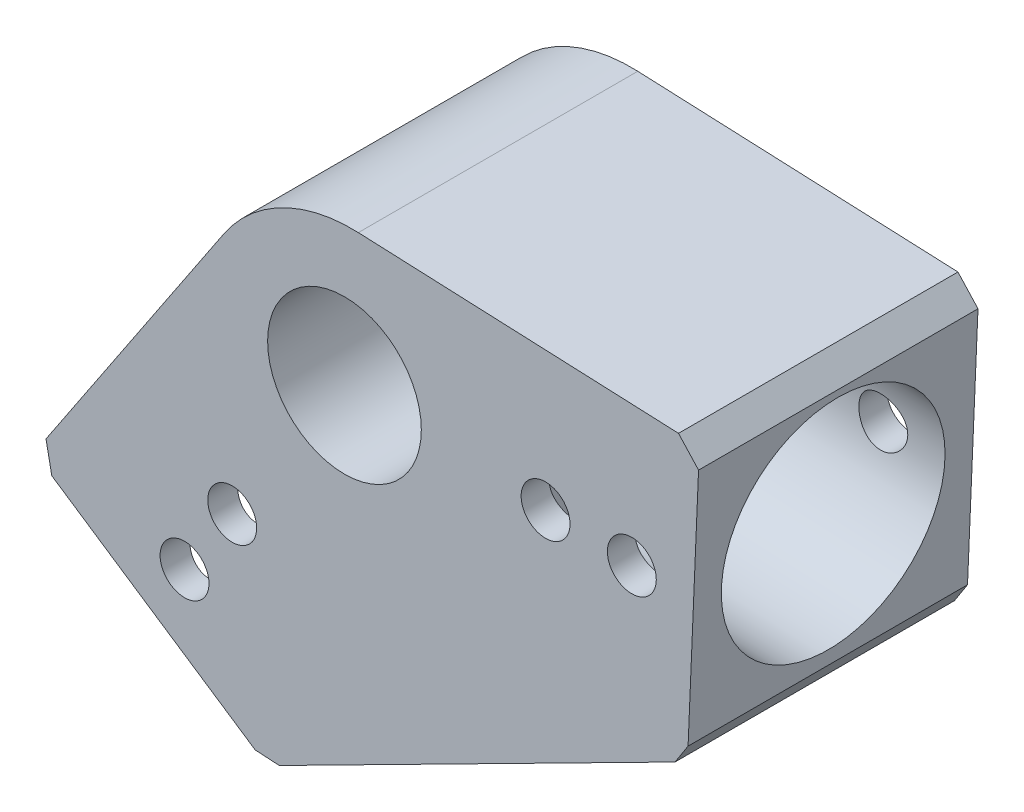
from build123d import *

# Parameters (mm, degrees)
BOSS_EXTRUDE6_DEPTH = 40
SKETCH9_R           = 16
CUT_EXTRUDE3_DEPTH  = 30
SKETCH10_R          = 16
CUT_EXTRUDE4_DEPTH  = 30
CUT_EXTRUDE5_REACH  = 89.959
SKETCH11_R          = 3.5
SKETCH12_R          = 11
CUT_EXTRUDE6_DEPTH  = 40
SKETCH14_W          = 106.764973624
SKETCH14_H          = 40
BOSS_EXTRUDE7_DEPTH = 5
CUT_EXTRUDE8_DEPTH  = 40
FILLET1_R           = 22
CHAMFER5_SIZE       = 2
CHAMFER6_SIZE       = 3
SKETCH16_R          = 5
CUT_EXTRUDE9_DEPTH  = 27


with BuildPart() as part:
    # Sketch8 → Boss-Extrude6 (new body)
    with BuildSketch(Plane.XY):
        Polygon((-57.969476198, -3.736595203), (37.23247397, 44.588846099), (50.811489539, 17.83795198), (-44.390460629, -30.487489322), align=None)
        Polygon((50.811489539, 17.83795198), (49.096562756, -22.125268937), (-11.118961612, -52.691258219), (-44.390460629, -30.487489322), align=None)
    extrude(amount=BOSS_EXTRUDE6_DEPTH)

    # Sketch9 → Cut-Extrude3 (cut)
    with BuildSketch(Plane(origin=(-27.75471112, -41.58937377, 0), x_dir=(-0.8317874754097543, 0.5550942224086534, 0), z_dir=(-0.5550942224086534, -0.8317874754097543, 0))):
        with Locations(Location((0, -20, 0), (0, 0, 180))):
            Circle(SKETCH9_R)
    extrude(amount=-CUT_EXTRUDE3_DEPTH, mode=Mode.SUBTRACT)

    # Sketch10 → Cut-Extrude4 (cut)
    with BuildSketch(Plane(origin=(49.954026147, -2.143658479, 0), x_dir=(0, 0, -1), z_dir=(0.9990805229464255, -0.04287316957138965, 0))):
        with Locations(Location((-20, 0, 0), (0, 0, 90))):
            Circle(SKETCH10_R)
    extrude(amount=-CUT_EXTRUDE4_DEPTH, mode=Mode.SUBTRACT)

    # Cut-Extrude5: up to this face of the body (flat: up to its plane)
    cut_extrude5_end = Plane(part.part.faces().sort_by_distance((3.278005206, -6.45772661, 40))[0])
    # Sketch11 → Cut-Extrude5 (cut, up to the picked face)
    with BuildSketch(Plane(origin=(0, 0, 0), x_dir=(-1, 0, 0), z_dir=(0, 0, -1)), mode=Mode.PRIVATE) as cut_extrude5_sk1:
        with Locations((16.072269088, -23.982451877)):
            Circle(SKETCH11_R)
    cut_extrude5_tool1 = split(extrude(cut_extrude5_sk1.sketch, amount=-CUT_EXTRUDE5_REACH, mode=Mode.PRIVATE), bisect_by=cut_extrude5_end, keep=Keep.BOTH, mode=Mode.PRIVATE)
    # Sketch11 → Cut-Extrude5 (cut, up to the picked face)
    with BuildSketch(Plane(origin=(0, 0, 0), x_dir=(-1, 0, 0), z_dir=(0, 0, -1)), mode=Mode.PRIVATE) as cut_extrude5_sk2:
        with Locations((22.894837472, -34.264871857)):
            Circle(SKETCH11_R)
    cut_extrude5_tool2 = split(extrude(cut_extrude5_sk2.sketch, amount=-CUT_EXTRUDE5_REACH, mode=Mode.PRIVATE), bisect_by=cut_extrude5_end, keep=Keep.BOTH, mode=Mode.PRIVATE)
    # Sketch11 → Cut-Extrude5 (cut, up to the picked face)
    with BuildSketch(Plane(origin=(0, 0, 0), x_dir=(-1, 0, 0), z_dir=(0, 0, -1)), mode=Mode.PRIVATE) as cut_extrude5_sk3:
        with Locations((-28.78289974, -1.065658383)):
            Circle(SKETCH11_R)
    cut_extrude5_tool3 = split(extrude(cut_extrude5_sk3.sketch, amount=-CUT_EXTRUDE5_REACH, mode=Mode.PRIVATE), bisect_by=cut_extrude5_end, keep=Keep.BOTH, mode=Mode.PRIVATE)
    # Sketch11 → Cut-Extrude5 (cut, up to the picked face)
    with BuildSketch(Plane(origin=(0, 0, 0), x_dir=(-1, 0, 0), z_dir=(0, 0, -1)), mode=Mode.PRIVATE) as cut_extrude5_sk4:
        with Locations((-41.131848905, -1.765246078)):
            Circle(SKETCH11_R)
    cut_extrude5_tool4 = split(extrude(cut_extrude5_sk4.sketch, amount=-CUT_EXTRUDE5_REACH, mode=Mode.PRIVATE), bisect_by=cut_extrude5_end, keep=Keep.BOTH, mode=Mode.PRIVATE)
    add(cut_extrude5_tool1.solids().sort_by(Axis((-16.072269, -23.982452, 0), (0, 0, 1)))[0], mode=Mode.SUBTRACT)
    add(cut_extrude5_tool2.solids().sort_by(Axis((-22.894837, -34.264872, 0), (0, 0, 1)))[0], mode=Mode.SUBTRACT)
    add(cut_extrude5_tool3.solids().sort_by(Axis((28.7829, -1.065658, 0), (0, 0, 1)))[0], mode=Mode.SUBTRACT)
    add(cut_extrude5_tool4.solids().sort_by(Axis((41.131849, -1.765246, 0), (0, 0, 1)))[0], mode=Mode.SUBTRACT)

    # Sketch12 → Cut-Extrude6 (cut)
    with BuildSketch(Plane(origin=(0, 0, 0), x_dir=(-1, 0, 0), z_dir=(0, 0, -1))):
        with Locations((0.002217481, -0.001125615)):
            Circle(SKETCH12_R)
    extrude(amount=-CUT_EXTRUDE6_DEPTH, mode=Mode.SUBTRACT)

    # Sketch14 → Boss-Extrude7 (add)
    with BuildSketch(Plane(origin=(-10.368501114, 20.426125448, 0), x_dir=(0.8916964706359383, 0.45263385230825515, 0), z_dir=(-0.45263385230825526, 0.8916964706359384, 0))):
        with Locations((0, -20)):
            Rectangle(SKETCH14_W, SKETCH14_H)
    extrude(amount=BOSS_EXTRUDE7_DEPTH)

    # Sketch15 → Cut-Extrude8 (cut)
    with BuildSketch(Plane(origin=(0, 0, 0), x_dir=(-1, 0, 0), z_dir=(0, 0, -1))):
        Polygon((20.486288281, 20.897526908), (10.387815393, 20.46417491), (44.390460629, -30.487489322), (60.232645459, 0.72188715), align=None)
        Polygon((-34.969304708, 49.047328453), (-50.811489539, 17.83795198), (10.387815393, 20.46417491), (4.777052471, 28.871688695), align=None)
        Polygon((4.777052471, 28.871688695), (10.387815393, 20.46417491), (20.486288281, 20.897526908), align=None)
    extrude(amount=-CUT_EXTRUDE8_DEPTH, mode=Mode.SUBTRACT)

    # Fillet1
    fillet1_edges = [part.edges().sort_by_distance(p)[0] for p in [
        (-10.387815393, 20.46417491, 20),
    ]]
    fillet(fillet1_edges, radius=FILLET1_R)

    # Chamfer5
    chamfer5_edges = [part.edges().sort_by_distance(p)[0] for p in [
        (49.096562756, -22.125268937, 20),
        (-11.118961612, -52.691258219, 20),
    ]]
    chamfer(chamfer5_edges, length=CHAMFER5_SIZE)

    # Chamfer6
    chamfer6_edges = [part.edges().sort_by_distance(p)[0] for p in [
        (50.811489539, 17.83795198, 20),
        (-44.390460629, -30.487489322, 20),
    ]]
    chamfer(chamfer6_edges, length=CHAMFER6_SIZE)

    # Sketch16 → Cut-Extrude9 (cut)
    with BuildSketch(Plane(origin=(18.988800572, -37.408263578, 0), x_dir=(-0.8916964706359382, -0.4526338523082556, 0), z_dir=(0.4526338523082556, -0.8916964706359382, 0))):
        with Locations(Location((-1.764586017, -20, 0), (0, 0, 180))):
            Circle(SKETCH16_R)
    extrude(amount=-CUT_EXTRUDE9_DEPTH, mode=Mode.SUBTRACT)


solid = part.part
